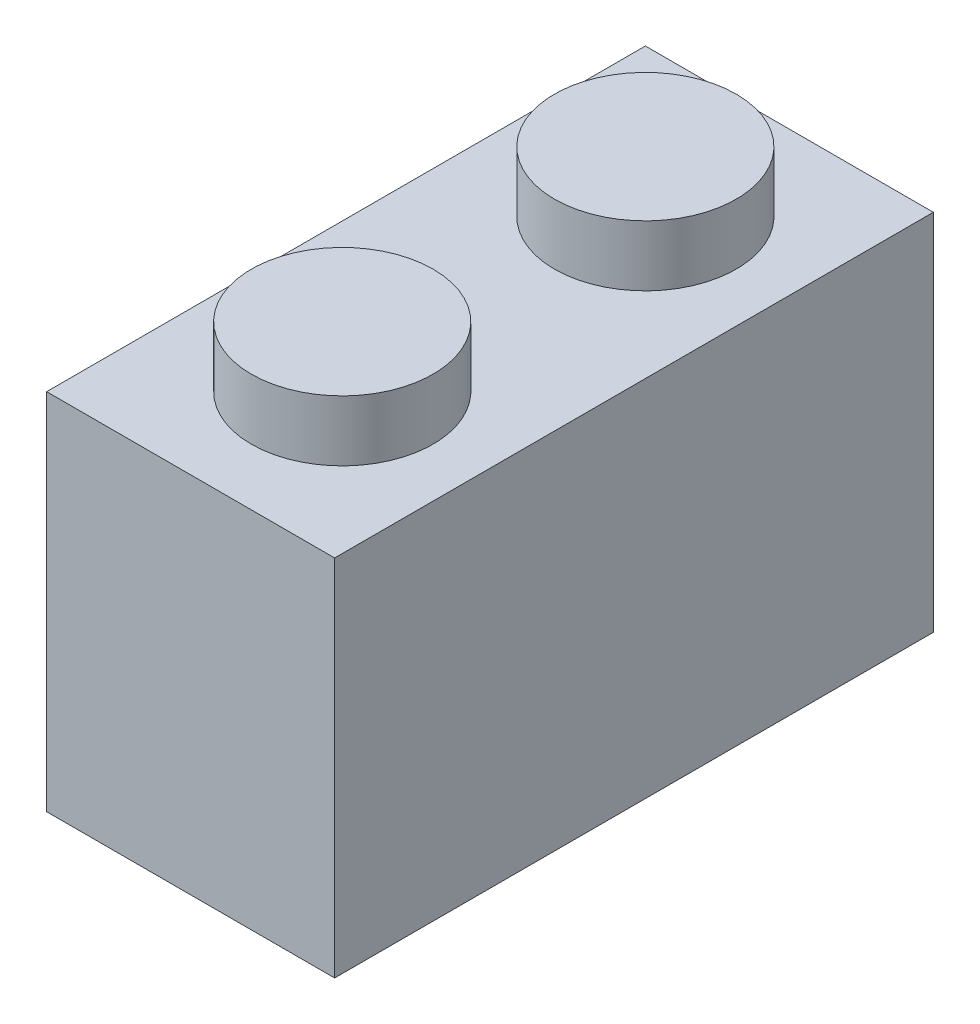
from build123d import *

# Parameters (mm, degrees)
SKETCH1_W            = 7.6
SKETCH1_H            = 9.6
BOSS_EXTRUDE1_DEPTH  = 15.8
SKETCH2_R            = 2.4
BOSS_EXTRUDE2_DEPTH  = 1.6
LPATTERN1_COUNT      = 2
LPATTERN1_PITCH      = 8
LPATTERN1_COUNT_DIR2 = 4
LPATTERN1_PITCH_DIR2 = 8
SHELL1_T             = -1.2


with BuildPart() as part:
    # Sketch1 → Boss-Extrude1 (new body)
    with BuildSketch(Plane.XY):
        with Locations((3.8, 4.8)):
            Rectangle(SKETCH1_W, SKETCH1_H)
    extrude(amount=-BOSS_EXTRUDE1_DEPTH)

    # Sketch2 → Boss-Extrude2 (add)
    with BuildSketch(Plane(origin=(0, 9.6, 0), x_dir=(1, 0, 0), z_dir=(0, 1, 0))):
        with Locations(Location((3.9, 3.9, 0), (0, 0, 270))):
            Circle(SKETCH2_R)
    boss_extrude2 = extrude(amount=BOSS_EXTRUDE2_DEPTH)

    # LPattern1: Boss-Extrude2 2 × 4, 6 skipped
    with Locations(*[(-j * LPATTERN1_PITCH_DIR2, 0, -i * LPATTERN1_PITCH) for i in range(LPATTERN1_COUNT) for j in range(LPATTERN1_COUNT_DIR2) if (i, j) not in ((0, 0), (0, 1), (0, 2), (0, 3), (1, 1), (1, 2), (1, 3))]):
        add(boss_extrude2)

    # Shell1
    shell1_openings = [part.faces().sort_by_distance(p)[0] for p in [
        (3.8, 0, -7.9),
    ]]
    offset(amount=SHELL1_T, openings=shell1_openings, kind=Kind.INTERSECTION)


solid = part.part
